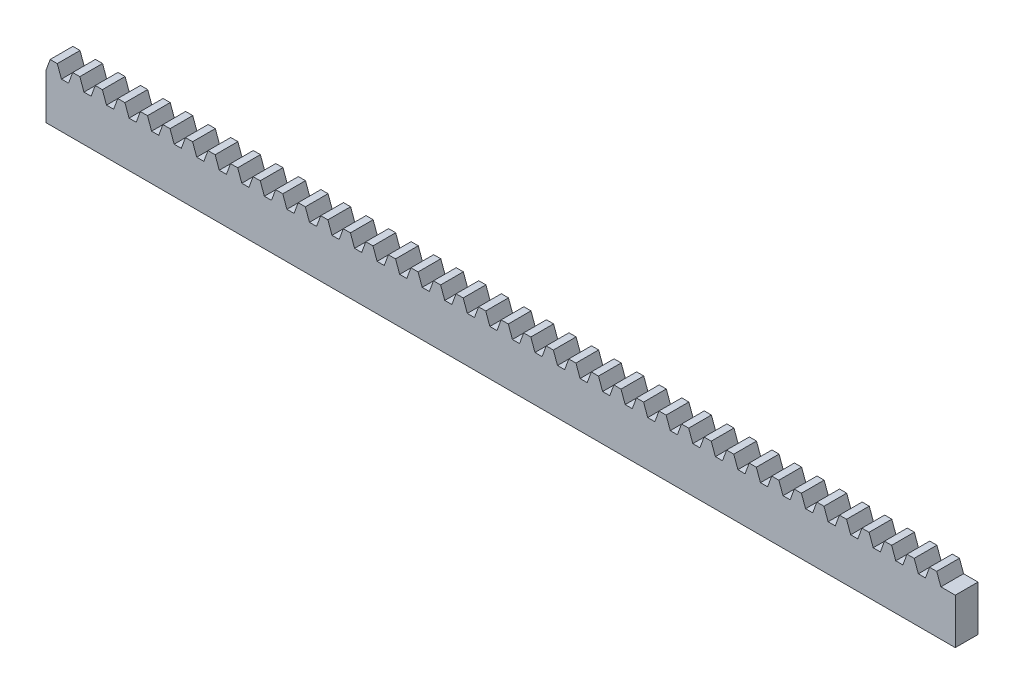
from build123d import *

# Parameters (mm, degrees)
SKETCH_1_W             = 200
SKETCH_1_H             = 10
EXTRUDE_1_DEPTH        = 5
EXTRUDE_2_DEPTH        = 5
PATTERN_LINEAR_1_COUNT = 40
PATTERN_LINEAR_1_PITCH = 4.96


with BuildPart() as part:
    # 草图1 → 拉伸1 (new body)
    with BuildSketch(Plane.XY):
        with Locations((100, -5)):
            Rectangle(SKETCH_1_W, SKETCH_1_H)
    extrude(amount=EXTRUDE_1_DEPTH)

    # 草图2 → 拉伸2 (add)
    with BuildSketch(Plane.XY.offset(5)):
        Polygon((0.909925586, 2.5), (0, 0), (3.390647498, 0), (2.480721912, 2.5), align=None)
    extrude_2 = extrude(amount=-EXTRUDE_2_DEPTH)

    # 阵列(线性)1: 拉伸2 ×40
    with Locations(*[(i * PATTERN_LINEAR_1_PITCH, 0, 0) for i in range(1, PATTERN_LINEAR_1_COUNT)]):
        add(extrude_2)


solid = part.part
